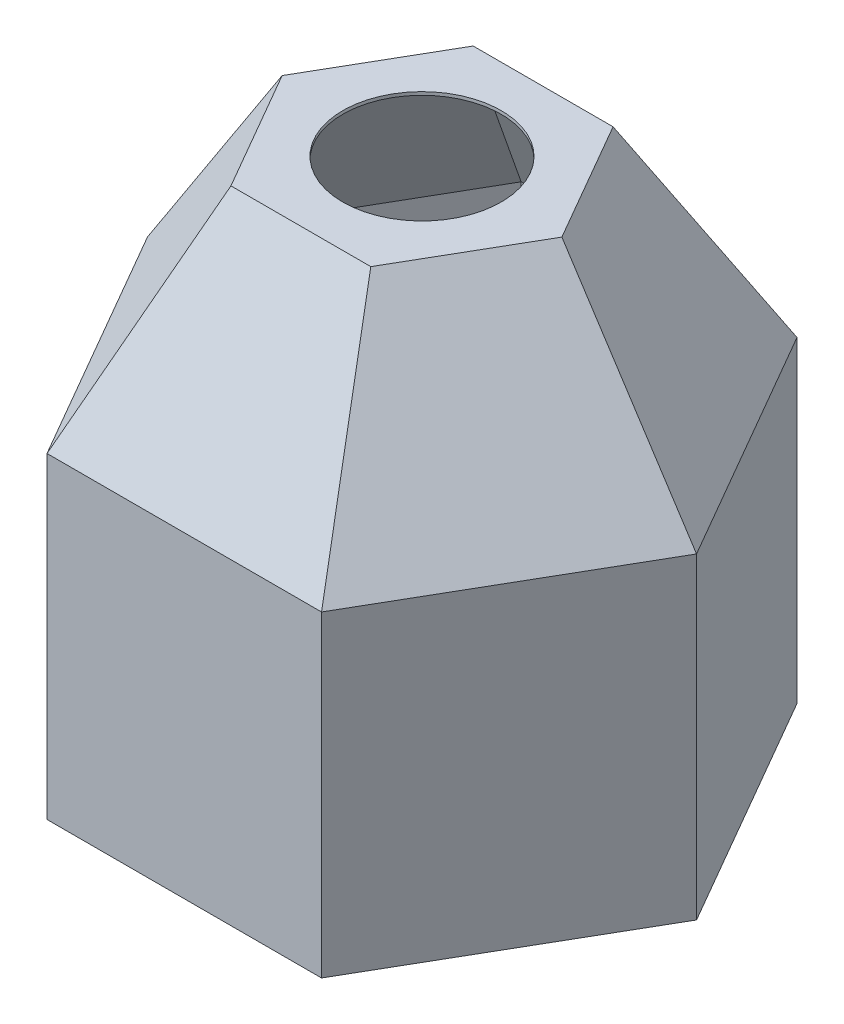
from build123d import *

# Parameters (mm, degrees)
BOSS_EXTRUDE2_DEPTH = 304.8
CUT_EXTRUDE1_DEPTH  = 304.8
BOSS_EXTRUDE3_DEPTH = 3.048
SKETCH11_R          = 76.2
CUT_EXTRUDE2_DEPTH  = 3.048
BOSS_EXTRUDE4_DEPTH = 3.048


with BuildPart() as part:
    # Sketch4 → Boss-Extrude2 (new body)
    with BuildSketch(Plane(origin=(0, 0, 0), x_dir=(1, 0, 0), z_dir=(0, 1, 0))):
        Polygon((263.964543073, 0), (131.982271537, 228.6), (-131.982271537, 228.6), (-263.964543073, 0), (-131.982271537, -228.6), (131.982271537, -228.6), align=None)
    extrude(amount=BOSS_EXTRUDE2_DEPTH)

    # Sketch5 → section 0 of loft1
    with BuildSketch(Plane(origin=(0, 503.936, 0), x_dir=(1, 0, 0), z_dir=(0, 1, 0)), mode=Mode.PRIVATE) as loft1_s0:
        with BuildLine():
            Line((134.493, 0), (67.2465, 116.474354631))
            Line((67.2465, 116.474354631), (-67.2465, 116.474354631))
            Line((-67.2465, 116.474354631), (-134.493, 0))
            Line((-134.493, 0), (-67.2465, -116.474354631))
            Line((-67.2465, -116.474354631), (67.2465, -116.474354631))
            Line((67.2465, -116.474354631), (134.493, 0))
        make_face()
    # loft up to a face of the part (loft1)
    loft([loft1_s0.sketch, part.faces().sort_by_distance((0, 304.8, 0))[0]])

    # Sketch7 → Cut-Extrude1 (cut)
    with BuildSketch(Plane(origin=(0, 0, 0), x_dir=(-1, 0, 0), z_dir=(0, -1, 0))):
        Polygon((-260.445015833, 0), (-130.222507916, -225.552), (130.222507916, -225.552), (260.445015833, 0), (130.222507916, 225.552), (-130.222507916, 225.552), align=None)
    extrude(amount=-CUT_EXTRUDE1_DEPTH, mode=Mode.SUBTRACT)

    # Sketch8 → section 0 of cut_loft2
    with BuildSketch(Plane(origin=(0, 503.936, 0), x_dir=(1, 0, 0), z_dir=(0, 1, 0)), mode=Mode.PRIVATE) as cut_loft2_s0:
        with BuildLine():
            Line((130.973472817, 0), (65.486736408, 113.426354681))
            Line((65.486736408, 113.426354681), (-65.486736408, 113.426354681))
            Line((-65.486736408, 113.426354681), (-130.973472817, 0))
            Line((-130.973472817, 0), (-65.486736408, -113.426354681))
            Line((-65.486736408, -113.426354681), (65.486736408, -113.426354681))
            Line((65.486736408, -113.426354681), (130.973472817, 0))
        make_face()
    # loft up to a face of the part (cut_loft2)
    loft([cut_loft2_s0.sketch, part.faces().sort_by_distance((0, 304.8, 0))[0]], mode=Mode.SUBTRACT)

    # Sketch10 → Boss-Extrude3 (add)
    with BuildSketch(Plane(origin=(0, 503.936, 0), x_dir=(1, 0, 0), z_dir=(0, 1, 0))):
        Polygon((134.493, 0), (67.2465, 116.474354631), (-67.2465, 116.474354631), (-134.493, 0), (-67.2465, -116.474354631), (67.2465, -116.474354631), align=None)
    extrude(amount=-BOSS_EXTRUDE3_DEPTH)

    # Sketch11 → Cut-Extrude2 (cut)
    with BuildSketch(Plane(origin=(0, 503.936, 0), x_dir=(1, 0, 0), z_dir=(0, 1, 0))):
        with Locations(Location((0, 0, 0), (0, 0, 270))):
            Circle(SKETCH11_R)
    extrude(amount=-CUT_EXTRUDE2_DEPTH, mode=Mode.SUBTRACT)

    # Sketch13 → Boss-Extrude4 (add)
    with BuildSketch(Plane(origin=(0, 0, 0), x_dir=(-1, 0, 0), z_dir=(0, -1, 0))):
        Polygon((-260.445015833, 0), (-130.222507916, -225.552), (130.222507916, -225.552), (260.445015833, 0), (130.222507916, 225.552), (-130.222507916, 225.552), align=None)
    extrude(amount=-BOSS_EXTRUDE4_DEPTH)


solid = part.part
